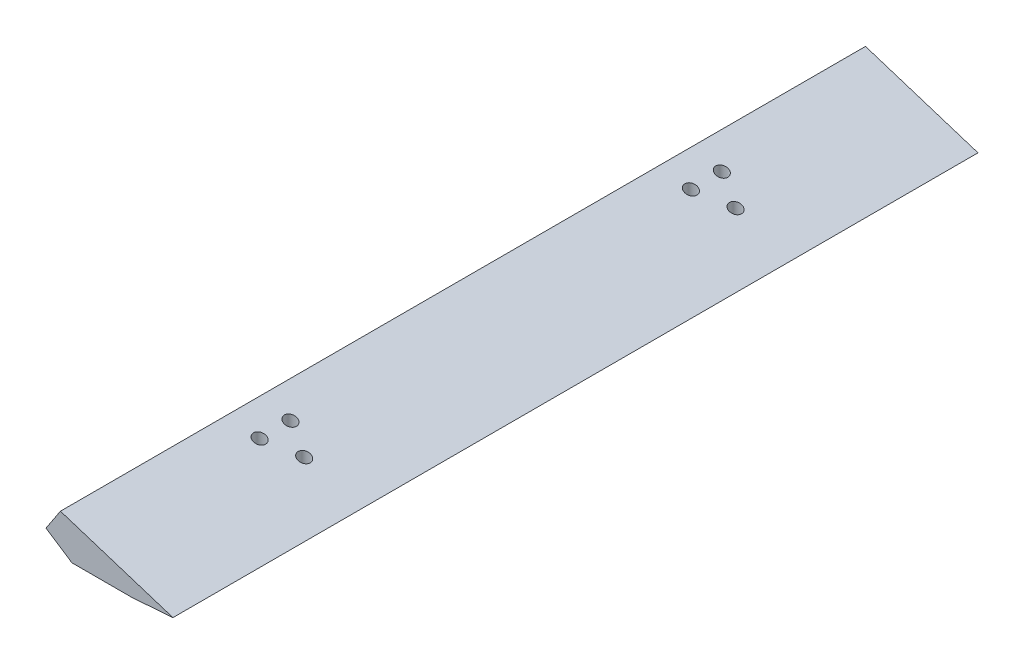
from build123d import *

# Parameters (mm, degrees)
EXTRUDE_1_DEPTH     = 100
SKETCH_2_R          = 1.5
CUT_EXTRUDE_1_DEPTH = 102.998720838


with BuildPart() as part:
    # 草图1 → 凸台-拉伸1 (new, symmetric)
    with BuildSketch(Plane.XY):
        Polygon((-7.5, 0), (7.5, 0), (17.60781312, 0.755729128), (-10.342998863, 9.680081085), (-13.930964167, 4.246815329), align=None)
    extrude(amount=EXTRUDE_1_DEPTH, both=True)

    # 草图2 → 切除-拉伸1 (cut, through all)
    with BuildSketch(Plane.XZ):
        with Locations(Location((3.794045685, 53.578973455, 0), (0, 0, 270))):
            Circle(SKETCH_2_R)
        with Locations(Location((3.794045685, -53.578973455, 0), (0, 0, 270))):
            Circle(SKETCH_2_R)
        with Locations(Location((-3.452778586, 57.415298026, 0), (0, 0, 270))):
            Circle(SKETCH_2_R)
        with Locations(Location((-3.452778586, 49.742648885, 0), (0, 0, 270))):
            Circle(SKETCH_2_R)
        with Locations(Location((-3.452778586, -49.742648885, 0), (0, 0, 270))):
            Circle(SKETCH_2_R)
        with Locations(Location((-3.452778586, -57.415298026, 0), (0, 0, 270))):
            Circle(SKETCH_2_R)
    extrude(amount=-CUT_EXTRUDE_1_DEPTH, mode=Mode.SUBTRACT)


solid = part.part
